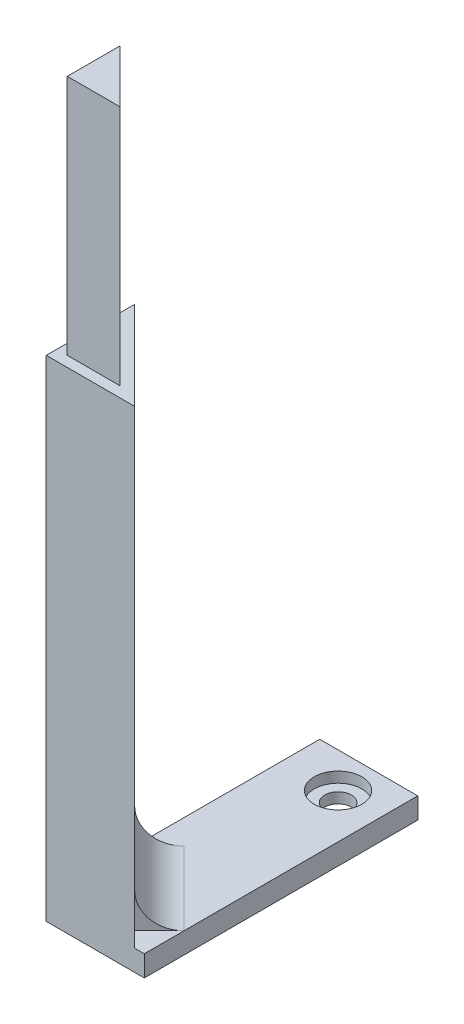
from build123d import *

# Parameters (mm, degrees)
BOSS_EXTRUDE3_DEPTH = 320
SKETCH7_W           = 15
SKETCH7_H           = 111
CUT_EXTRUDE3_DEPTH  = 321.702354216
BOSS_EXTRUDE7_DEPTH = 140
SKETCH4_W           = 28
SKETCH4_H           = 78.1
SKETCH4_R           = 3.8
BOSS_EXTRUDE4_DEPTH = 6
BOSS_EXTRUDE8_DEPTH = 10
CUT_EXTRUDE4_DEPTH  = 226.646771605
SKETCH13_R          = 6.8
CUT_EXTRUDE5_DEPTH  = 3


with BuildPart() as part:
    # Sketch1 → Boss-Extrude3 (new body)
    with BuildSketch(Plane(origin=(0, 0, 0), x_dir=(1, 0, 0), z_dir=(0, 1, 0))):
        Polygon((0, 0), (0, 15), (15, 0), align=None)
    extrude(amount=BOSS_EXTRUDE3_DEPTH)

    # Sketch7 → Cut-Extrude3 (cut, through all)
    with BuildSketch(Plane.XY):
        with Locations((7.5, 264.5)):
            Rectangle(SKETCH7_W, SKETCH7_H)
    extrude(amount=-CUT_EXTRUDE3_DEPTH, mode=Mode.SUBTRACT)

    # Sketch10 → Boss-Extrude7 (add)
    with BuildSketch(Plane.XZ):
        Polygon((-3, 3), (-3, -22.242640687), (22.242640687, 3), align=None)
    extrude(amount=-BOSS_EXTRUDE7_DEPTH)

    # Sketch4 → Boss-Extrude4 (add)
    with BuildSketch(Plane.XZ):
        with Locations((11, -36.05)):
            Rectangle(SKETCH4_W, SKETCH4_H)
        with Locations(Location((12.3, -65.04, 0), (0, 0, 270))):
            Circle(SKETCH4_R, mode=Mode.SUBTRACT)
    extrude(amount=-BOSS_EXTRUDE4_DEPTH)

    # Sketch11 → Boss-Extrude8 (add)
    with BuildSketch(Plane(origin=(0, 6, 0), x_dir=(1, 0, 0), z_dir=(0, 1, 0))):
        Polygon((-3, 22.242640687), (4.071067812, 29.313708499), (19.315705646, 14.069070665), (25, 8.384776311), (17.928932188, 1.313708499), align=None)
    extrude(amount=BOSS_EXTRUDE8_DEPTH)

    # Sketch12 → Cut-Extrude4 (cut, through all)
    with BuildSketch(Plane(origin=(8.307611845, 0, 8.307611845), x_dir=(0.7071067811865472, 0, -0.7071067811865479), z_dir=(0.7071067811865479, 0, 0.7071067811865472))):
        with BuildLine():
            Line((13.606601718, 16), (23.606601718, 16))
            Line((23.606601718, 16), (23.606601718, 6))
            ThreePointArc((23.606601718, 6), (16.535533906, 8.928932188), (13.606601718, 16))
        make_face()
    extrude(amount=-CUT_EXTRUDE4_DEPTH, mode=Mode.SUBTRACT)

    # Sketch13 → Cut-Extrude5 (cut)
    with BuildSketch(Plane(origin=(0, 6, 0), x_dir=(1, 0, 0), z_dir=(0, 1, 0))):
        with Locations(Location((12.3, 65.04, 0), (0, 0, 270))):
            Circle(SKETCH13_R)
    extrude(amount=-CUT_EXTRUDE5_DEPTH, mode=Mode.SUBTRACT)


solid = part.part
